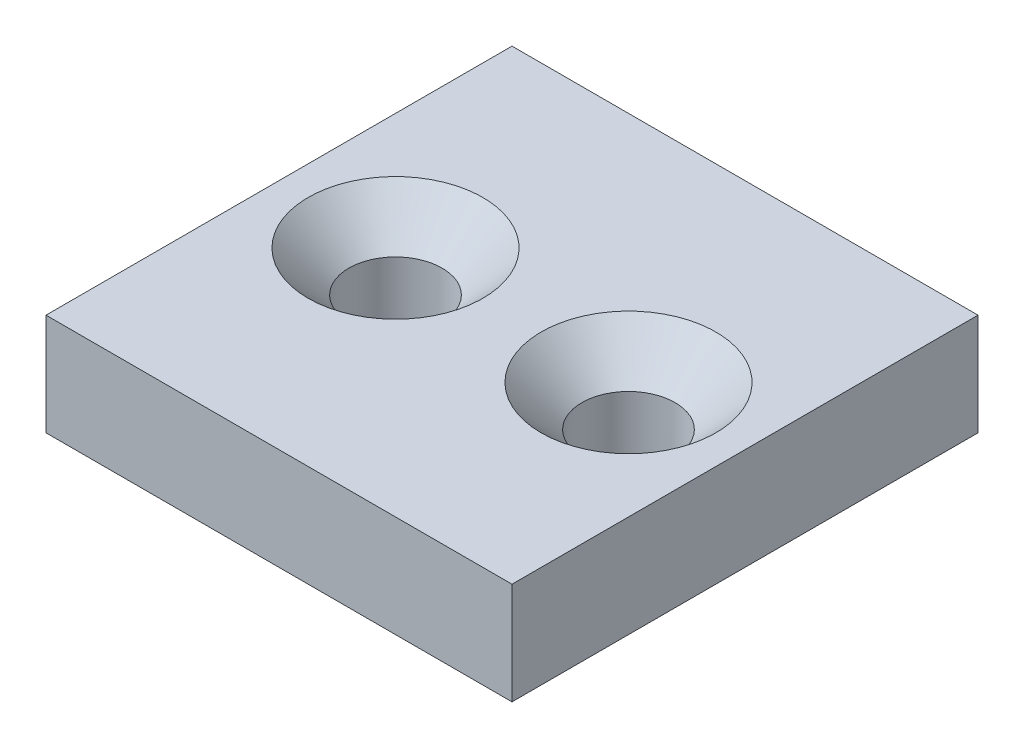
from build123d import *

# Parameters (mm, degrees)
SKETCH1_W                                       = 32
SKETCH1_H                                       = 32
BOSS_EXTRUDE1_DEPTH                             = 7
CSK_FOR_M6_FLAT_HEAD_MACHINE_SCREW1_D           = 6.4
CSK_FOR_M6_FLAT_HEAD_MACHINE_SCREW1_CSINK_D     = 12
CSK_FOR_M6_FLAT_HEAD_MACHINE_SCREW1_CSINK_ANGLE = 90


with BuildPart() as part:
    # Sketch1 → Boss-Extrude1 (new body)
    with BuildSketch(Plane(origin=(0, 0, 0), x_dir=(1, 0, 0), z_dir=(0, 1, 0))):
        Rectangle(SKETCH1_W, SKETCH1_H)
    extrude(amount=BOSS_EXTRUDE1_DEPTH)

    # CSK for M6 Flat Head Machine Screw1 (through all)
    with Locations(Plane(origin=(0, 7, 0), x_dir=(1, 0, 0), z_dir=(0, 1, 0))):
        with Locations((8, 0), (-8, 0)):
            CounterSinkHole(CSK_FOR_M6_FLAT_HEAD_MACHINE_SCREW1_D / 2, CSK_FOR_M6_FLAT_HEAD_MACHINE_SCREW1_CSINK_D / 2, counter_sink_angle=CSK_FOR_M6_FLAT_HEAD_MACHINE_SCREW1_CSINK_ANGLE)


solid = part.part
